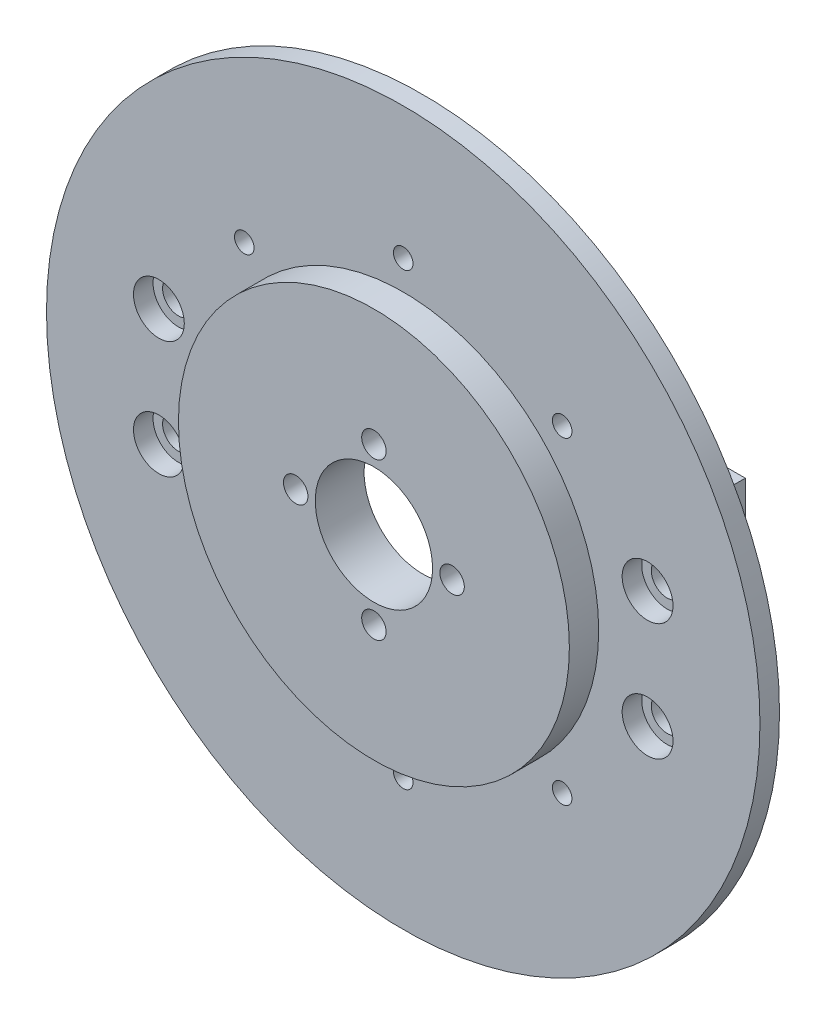
from build123d import *

# Parameters (mm, degrees)
SKETCH_1_W               = 60
SKETCH_1_H               = 32
EXTRUDE_1_DEPTH          = 3
SKETCH_3_R               = 36.5
EXTRUDE_2_DEPTH          = 2
SKETCH_4_R               = 1
CUT_EXTRUDE_2_DEPTH      = 10
PATTERN_CIRCULAR_1_COUNT = 8
SKETCH_5_R               = 5
CUT_EXTRUDE_3_DEPTH      = 3
SKETCH_6_R               = 3
EXTRUDE_3_DEPTH          = 5
SKETCH_7_R               = 1.62
CUT_EXTRUDE_4_DEPTH      = 5
SKETCH_9_R               = 2.6
CUT_EXTRUDE_5_DEPTH      = 2
SKETCH_10_R              = 20
EXTRUDE_4_DEPTH          = 3
SKETCH_11_R              = 1.25
CUT_EXTRUDE_6_DEPTH      = 10
PATTERN_CIRCULAR_2_COUNT = 4
SKETCH_12_W              = 42.513020476
SKETCH_12_H              = 32
CUT_EXTRUDE_7_DEPTH      = 3
SKETCH_13_R              = 6
CUT_EXTRUDE_8_DEPTH      = 10


with BuildPart() as part:
    # 草图1 → 凸台-拉伸1 (new body)
    with BuildSketch(Plane.XY):
        with Locations((-44.89426993, 6.0842078)):
            Rectangle(SKETCH_1_W, SKETCH_1_H)
    extrude(amount=EXTRUDE_1_DEPTH)

    # 草图3 → 凸台-拉伸2 (add)
    with BuildSketch(Plane.XY.offset(3)):
        with Locations((-44.89426993, 6.0842078)):
            Circle(SKETCH_3_R)
    extrude(amount=EXTRUDE_2_DEPTH)

    # 草图4 → 切除-拉伸2 (cut)
    with BuildSketch(Plane.XY.offset(5)):
        with Locations((-44.89426993, 29.0842078)):
            Circle(SKETCH_4_R)
    cut_extrude_2 = extrude(amount=-CUT_EXTRUDE_2_DEPTH, mode=Mode.SUBTRACT)

    # 阵列(圆周)1: 切除-拉伸2 ×8 about axis
    pattern_circular_1_axis = Axis((-44.89426993, 6.0842078, 0), (0, 0, 1))
    for i in range(1, PATTERN_CIRCULAR_1_COUNT):
        add(cut_extrude_2.rotate(pattern_circular_1_axis, i * 360 / PATTERN_CIRCULAR_1_COUNT), mode=Mode.SUBTRACT)

    # 草图5 → 切除-拉伸3 (cut)
    with BuildSketch(Plane(origin=(0, 0, 0), x_dir=(-1, 0, 0), z_dir=(0, 0, -1))):
        with Locations((28.630813963, 22.347663767)):
            Circle(SKETCH_5_R)
        with Locations((61.157725897, 22.347663767)):
            Circle(SKETCH_5_R)
        with Locations((28.630813963, -10.179248167)):
            Circle(SKETCH_5_R)
        with Locations((61.157725897, -10.179248167)):
            Circle(SKETCH_5_R)
    extrude(amount=-CUT_EXTRUDE_3_DEPTH, mode=Mode.SUBTRACT)

    # 草图6 → 凸台-拉伸3 (add)
    with BuildSketch(Plane(origin=(0, 0, 0), x_dir=(-1, 0, 0), z_dir=(0, 0, -1))):
        with Locations((21.89426993, 6.0842078)):
            Circle(SKETCH_6_R)
        with Locations((67.89426993, 6.0842078)):
            Circle(SKETCH_6_R)
    extrude(amount=-EXTRUDE_3_DEPTH)

    # 草图7 → 切除-拉伸4 (cut)
    with BuildSketch(Plane(origin=(0, 0, 0), x_dir=(-1, 0, 0), z_dir=(0, 0, -1))):
        with Locations((19.89426993, 12.0842078)):
            Circle(SKETCH_7_R)
        with Locations((19.89426993, 0.0842078)):
            Circle(SKETCH_7_R)
        with Locations((69.89426993, 12.0842078)):
            Circle(SKETCH_7_R)
        with Locations((69.89426993, 0.0842078)):
            Circle(SKETCH_7_R)
    extrude(amount=-CUT_EXTRUDE_4_DEPTH, mode=Mode.SUBTRACT)

    # 草图9 → 切除-拉伸5 (cut)
    with BuildSketch(Plane.XY.offset(5)):
        with Locations((-69.89426993, 12.0842078)):
            Circle(SKETCH_9_R)
        with Locations((-69.89426993, 0.0842078)):
            Circle(SKETCH_9_R)
        with Locations((-19.89426993, 12.0842078)):
            Circle(SKETCH_9_R)
        with Locations((-19.89426993, 0.0842078)):
            Circle(SKETCH_9_R)
    extrude(amount=-CUT_EXTRUDE_5_DEPTH, mode=Mode.SUBTRACT)

    # 草图10 → 凸台-拉伸4 (add)
    with BuildSketch(Plane.XY.offset(5)):
        with Locations((-44.89426993, 6.0842078)):
            Circle(SKETCH_10_R)
    extrude(amount=EXTRUDE_4_DEPTH)

    # 草图11 → 切除-拉伸6 (cut)
    with BuildSketch(Plane.XY.offset(8)):
        with Locations((-44.89426993, 14.0842078)):
            Circle(SKETCH_11_R)
    cut_extrude_6 = extrude(amount=-CUT_EXTRUDE_6_DEPTH, mode=Mode.SUBTRACT)

    # 阵列(圆周)2: 切除-拉伸6 ×4 about axis
    pattern_circular_2_axis = Axis((-44.89426993, 6.0842078, 0), (0, 0, 1))
    for i in range(1, PATTERN_CIRCULAR_2_COUNT):
        add(cut_extrude_6.rotate(pattern_circular_2_axis, i * 360 / PATTERN_CIRCULAR_2_COUNT), mode=Mode.SUBTRACT)

    # 草图12 → 切除-拉伸7 (cut)
    with BuildSketch(Plane(origin=(0, 0, 0), x_dir=(-1, 0, 0), z_dir=(0, 0, -1))):
        with Locations((44.89426993, 6.0842078)):
            Rectangle(SKETCH_12_W, SKETCH_12_H)
    extrude(amount=-CUT_EXTRUDE_7_DEPTH, mode=Mode.SUBTRACT)

    # 草图13 → 切除-拉伸8 (cut)
    with BuildSketch(Plane.XY.offset(8)):
        with Locations((-44.89426993, 6.0842078)):
            Circle(SKETCH_13_R)
    extrude(amount=-CUT_EXTRUDE_8_DEPTH, mode=Mode.SUBTRACT)


solid = part.part
